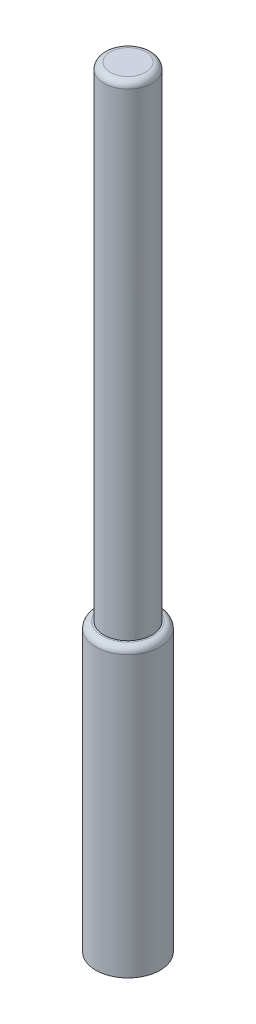
from build123d import *

# Parameters (mm, degrees)
SKETCH1_R           = 6.35
SKETCH1_R_2         = 4.7625
BOSS_EXTRUDE1_DEPTH = 56.642
SKETCH1_3_R         = 4.7625
BOSS_EXTRUDE2_DEPTH = 152.4
FILLET1_R           = 1.27


with BuildPart() as part:
    # Sketch1 → Boss-Extrude1 (new body)
    with BuildSketch(Plane(origin=(0, 0, 0), x_dir=(1, 0, 0), z_dir=(0, 1, 0))):
        Circle(SKETCH1_R)
        Circle(SKETCH1_R_2, mode=Mode.SUBTRACT)
    extrude(amount=BOSS_EXTRUDE1_DEPTH)

    # Sketch1<3> → Boss-Extrude2 (add)
    with BuildSketch(Plane(origin=(0, 0, 0), x_dir=(1, 0, 0), z_dir=(0, 1, 0))):
        Circle(SKETCH1_3_R)
    extrude(amount=BOSS_EXTRUDE2_DEPTH)

    # Fillet1
    fillet1_edges = [part.edges().sort_by_distance(p)[0] for p in [
        (-6.35, 56.642, 0),
        (-4.7625, 152.4, 0),
    ]]
    fillet(fillet1_edges, radius=FILLET1_R)


solid = part.part
